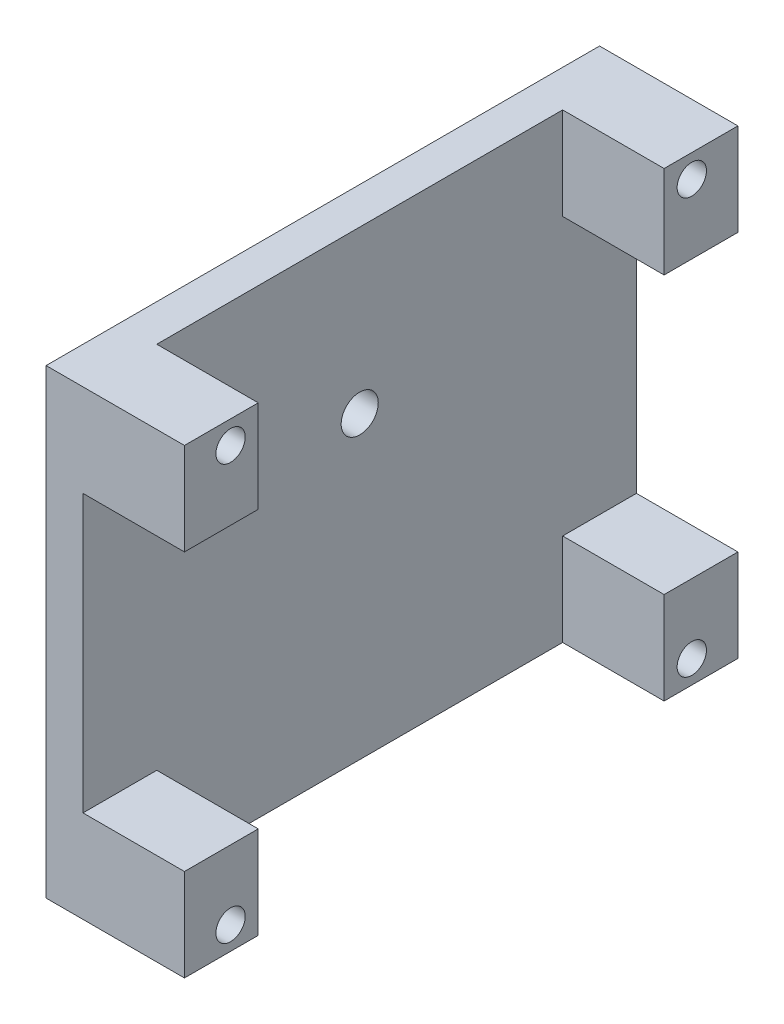
from build123d import *

# Parameters (mm, degrees)
SKETCH1_W                   = 76.2
SKETCH1_H                   = 63.5
BOSS_EXTRUDE1_DEPTH         = 19.05
SKETCH2_W                   = 55.88
SKETCH2_H                   = 63.5
CUT_EXTRUDE1_DEPTH          = 13.97
F_1_4_20_TAPPED_HOLE1_D     = 5.1054
F_1_4_20_TAPPED_HOLE1_DEPTH = 19.05
F_1_4_20_TAPPED_HOLE1_TIP   = 1.533816902
LPATTERN1_COUNT             = 2
LPATTERN1_PITCH             = 57.15
LPATTERN1_COUNT_DIR2        = 2
LPATTERN1_PITCH_DIR2        = 63.5
SKETCH7_W                   = 76.2
SKETCH7_H                   = 38.1
CUT_EXTRUDE2_DEPTH          = 13.97


with BuildPart() as part:
    # Sketch1 → Boss-Extrude1 (new body)
    with BuildSketch(Plane(origin=(0, 0, 0), x_dir=(0, 0, -1), z_dir=(1, 0, 0))):
        Rectangle(SKETCH1_W, SKETCH1_H)
    extrude(amount=BOSS_EXTRUDE1_DEPTH)

    # Sketch2 → Cut-Extrude1 (cut)
    with BuildSketch(Plane(origin=(19.05, 0, 0), x_dir=(0, 0, -1), z_dir=(1, 0, 0))):
        Rectangle(SKETCH2_W, SKETCH2_H)
    extrude(amount=-CUT_EXTRUDE1_DEPTH, mode=Mode.SUBTRACT)

    # Sketch5 → #10-32 Tapped Hole1 (revolve, cut)
    with BuildSketch(Plane(origin=(19.05, 28.575, 31.75), x_dir=(0, 0, -1), z_dir=(0, 1, 0))):
        Polygon((0, 0), (0, 14.929317848), (2.0193, 13.716), (2.0193, 0), align=None)
    f_10_32_tapped_hole1 = revolve(axis=Axis((25.4, 28.575, 31.75), (-1, 0, 0)), mode=Mode.SUBTRACT)

    # 1/4-20 Tapped Hole1
    with Locations(Plane(origin=(5.08, 0, 0), x_dir=(0, 0, -1), z_dir=(1, 0, 0))):
        with Locations((0, 9.525)):
            Hole(F_1_4_20_TAPPED_HOLE1_D / 2, depth=F_1_4_20_TAPPED_HOLE1_DEPTH)
            with Locations((0, 0, -(F_1_4_20_TAPPED_HOLE1_DEPTH + F_1_4_20_TAPPED_HOLE1_TIP / 2))):  # 118° drill point
                Cone(0, F_1_4_20_TAPPED_HOLE1_D / 2, F_1_4_20_TAPPED_HOLE1_TIP, mode=Mode.SUBTRACT)

    # LPattern1: 10-32 Tapped Hole1 2 × 2
    with Locations(*[(0, -i * LPATTERN1_PITCH, -j * LPATTERN1_PITCH_DIR2) for i in range(LPATTERN1_COUNT) for j in range(LPATTERN1_COUNT_DIR2) if (i, j) != (0, 0)]):
        add(f_10_32_tapped_hole1, mode=Mode.SUBTRACT)

    # Sketch7 → Cut-Extrude2 (cut)
    with BuildSketch(Plane(origin=(19.05, 0, 0), x_dir=(0, 0, -1), z_dir=(1, 0, 0))):
        Rectangle(SKETCH7_W, SKETCH7_H)
    extrude(amount=-CUT_EXTRUDE2_DEPTH, mode=Mode.SUBTRACT)


solid = part.part
